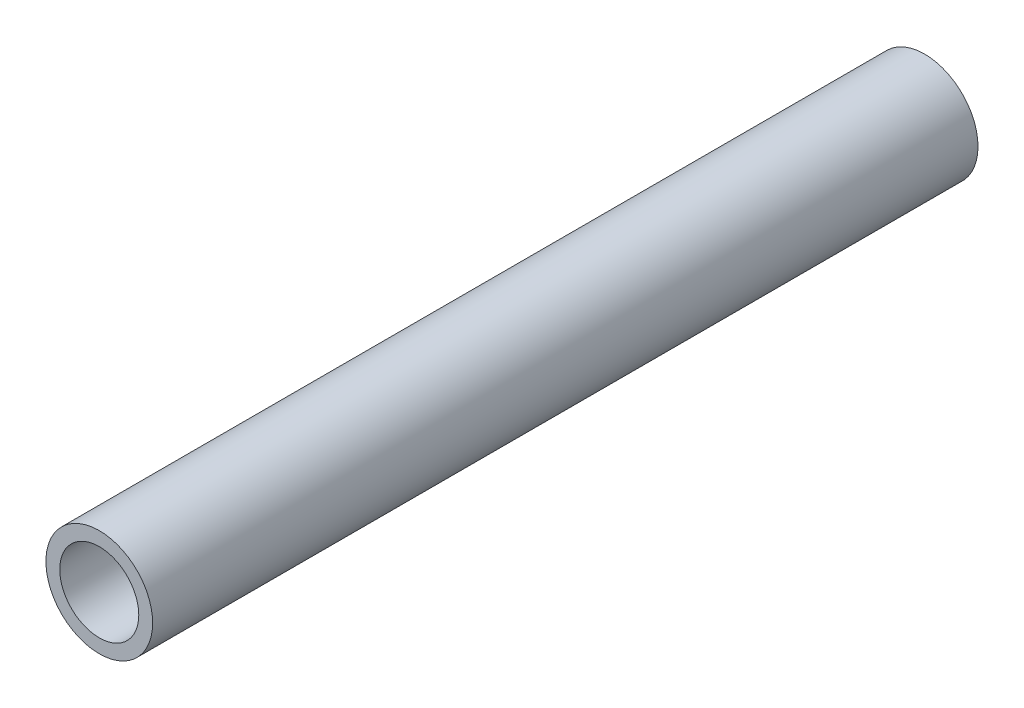
from build123d import *

# Parameters (mm, degrees)
SKETCH1_R           = 10.668
SKETCH1_R_2         = 7.8994
EXTRUDE_THIN1_DEPTH = 82.5


with BuildPart() as part:
    # Sketch1 → Extrude-Thin1 (new, symmetric)
    with BuildSketch(Plane.XY):
        Circle(SKETCH1_R)
        Circle(SKETCH1_R_2, mode=Mode.SUBTRACT)
    extrude(amount=EXTRUDE_THIN1_DEPTH, both=True)


solid = part.part
